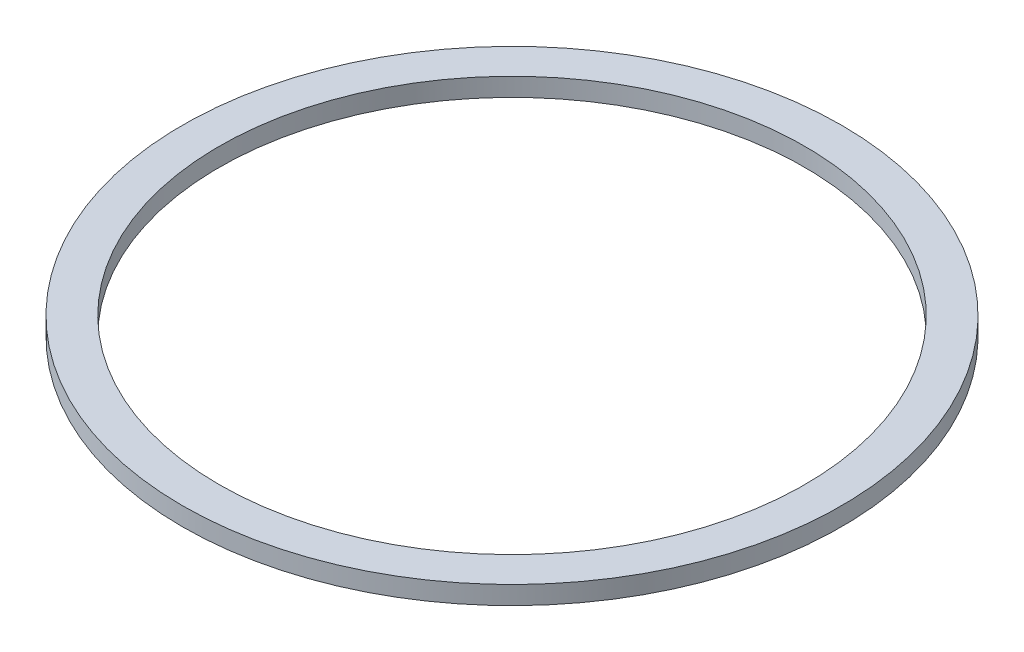
from build123d import *

# Parameters (mm, degrees)
ESQUISSE1_R        = 18
ESQUISSE1_R_2      = 16
BOSS_EXTRU_1_DEPTH = 1


with BuildPart() as part:
    # Esquisse1 → Boss.-Extru.1 (new body)
    with BuildSketch(Plane(origin=(0, 0, 0), x_dir=(1, 0, 0), z_dir=(0, 1, 0))):
        with Locations(Location((0, 0, 0), (0, 0, 270))):
            Circle(ESQUISSE1_R)
        with Locations(Location((0, 0, 0), (0, 0, 270))):
            Circle(ESQUISSE1_R_2, mode=Mode.SUBTRACT)
    extrude(amount=BOSS_EXTRU_1_DEPTH)


solid = part.part
